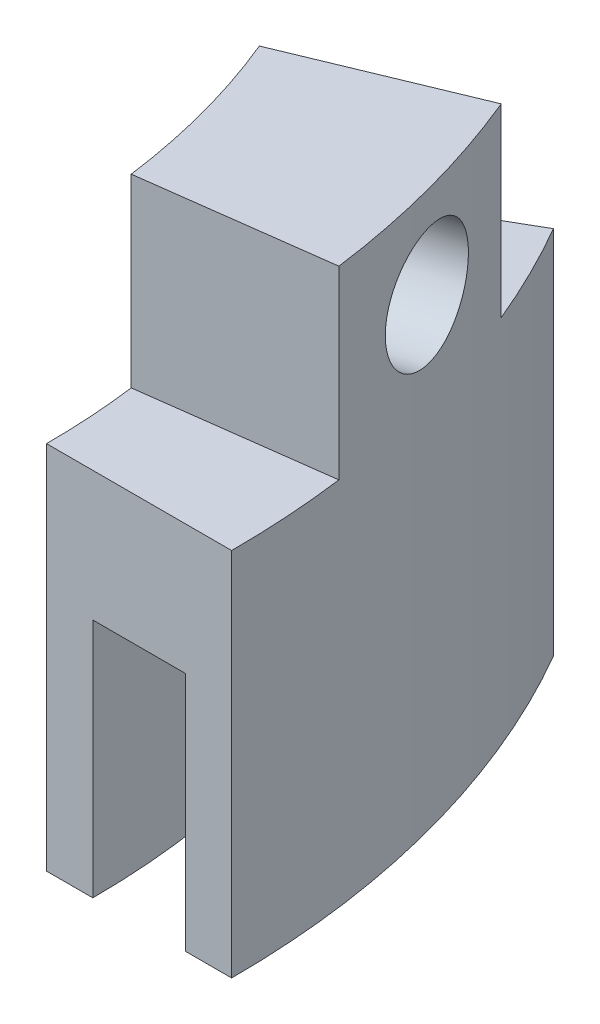
from build123d import *

# Parameters (mm, degrees)
BOSS_EXTRUDE1_DEPTH = 30
CUT_EXTRUDE1_DEPTH  = 13
CUT_EXTRUDE2_START  = -10
CUT_EXTRUDE2_DEPTH  = 10
SKETCH6_R           = 3.175
CUT_EXTRUDE3_DEPTH  = 36.083445782


with BuildPart() as part:
    # Sketch3 → Boss-Extrude1 (new body)
    with BuildSketch(Plane(origin=(0, 0, 0), x_dir=(1, 0, 0), z_dir=(0, 1, 0))):
        with BuildLine():
            Line((37.5, 0), (47.5, 0))
            ThreePointArc((47.5, 0), (45.881476749, 12.293904642), (41.13620668, 23.75))
            Line((41.13620668, 23.75), (32.475952642, 18.75))
            ThreePointArc((32.475952642, 18.75), (36.222218486, 9.705714191), (37.5, 0))
        make_face()
    extrude(amount=BOSS_EXTRUDE1_DEPTH)

    # Sketch4 → Cut-Extrude1 (cut)
    with BuildSketch(Plane(origin=(0, 0, 0), x_dir=(1, 0, 0), z_dir=(0, 1, 0))):
        with BuildLine():
            Line((34.641016151, 20), (38.97114317, 22.5))
            ThreePointArc((38.97114317, 22.5), (43.466662183, 11.64685703), (45, 0))
            Line((45, 0), (40, 0))
            ThreePointArc((40, 0), (38.637033052, 10.352761804), (34.641016151, 20))
        make_face()
    extrude(amount=CUT_EXTRUDE1_DEPTH, mode=Mode.SUBTRACT)

    # Sketch5 → Cut-Extrude2 (cut)
    with BuildSketch(Plane(origin=(0, 30, 0), x_dir=(1, 0, 0), z_dir=(0, 1, 0)).offset(CUT_EXTRUDE2_START)):
        with BuildLine():
            Line((41.13620668, 23.75), (32.475952642, 18.75))
            ThreePointArc((32.475952642, 18.75), (33.632727807, 16.585825883), (34.645482469, 14.350628714))
            Line((34.645482469, 14.350628714), (43.884277794, 18.177463037))
            ThreePointArc((43.884277794, 18.177463037), (42.601455223, 21.008712785), (41.13620668, 23.75))
        make_face()
    cut_extrude2 = extrude(amount=CUT_EXTRUDE2_DEPTH, mode=Mode.SUBTRACT)

    # Mirror1: Cut-Extrude2 across plane
    add(cut_extrude2.mirror(Plane(origin=(0, 0, 0), x_dir=(0.9659258262890681, 0, -0.25881904510252135), z_dir=(0.25881904510252135, 0, 0.9659258262890681))), mode=Mode.SUBTRACT)

    # Sketch6 → Cut-Extrude3 (cut, through all)
    with BuildSketch(Plane(origin=(45.881476749, 0, -12.293904642), x_dir=(-0.25881904510252135, 0, -0.9659258262890682), z_dir=(0.9659258262890681, 0, -0.2588190451025213))):
        with Locations((0, 25)):
            Circle(SKETCH6_R)
    extrude(amount=-CUT_EXTRUDE3_DEPTH, mode=Mode.SUBTRACT)


solid = part.part
